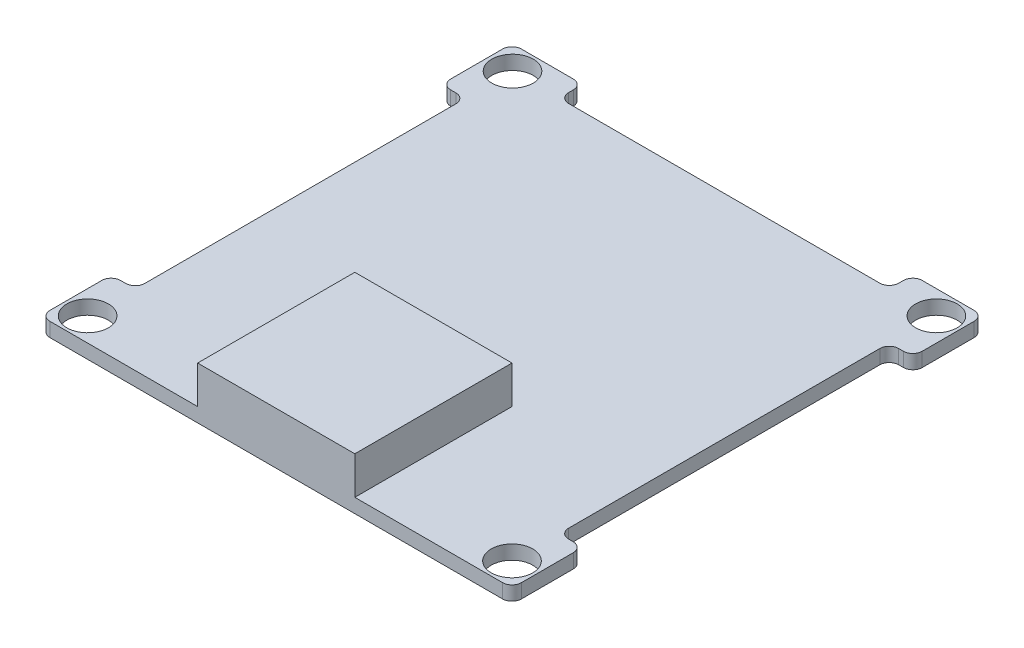
from build123d import *

# Parameters (mm, degrees)
SKETCH1_W           = 50
SKETCH1_H           = 50
SKETCH1_R           = 2.2
BOSS_EXTRUDE1_DEPTH = 1.5
SKETCH3_W           = 2.555545098
SKETCH3_H           = 35
SKETCH3_W_2         = 2.5
SKETCH3_W_3         = 35
SKETCH3_H_2         = 2.5
CUT_EXTRUDE1_DEPTH  = 1.5
FILLET8_R           = 1
SKETCH4_W           = 16.6666
SKETCH4_H           = 16.6666
BOSS_EXTRUDE2_DEPTH = 4


with BuildPart() as part:
    # Sketch1 → Boss-Extrude1 (new body)
    with BuildSketch(Plane(origin=(0, 0, 0), x_dir=(1, 0, 0), z_dir=(0, 1, 0))):
        with Locations((25, 25)):
            Rectangle(SKETCH1_W, SKETCH1_H)
        with Locations(Location((2.555545098, 47.5, 0), (0, 0, 270))):
            Circle(SKETCH1_R, mode=Mode.SUBTRACT)
        with Locations(Location((47.5, 47.5, 0), (0, 0, 270))):
            Circle(SKETCH1_R, mode=Mode.SUBTRACT)
        with Locations(Location((2.5, 2.5, 0), (0, 0, 270))):
            Circle(SKETCH1_R, mode=Mode.SUBTRACT)
        with Locations(Location((47.5, 2.5, 0), (0, 0, 270))):
            Circle(SKETCH1_R, mode=Mode.SUBTRACT)
    extrude(amount=BOSS_EXTRUDE1_DEPTH)

    # Sketch3 → Cut-Extrude1 (cut)
    with BuildSketch(Plane(origin=(0, 0, 0), x_dir=(1, 0, 0), z_dir=(0, 1, 0))):
        with Locations((1.277772549, 25)):
            Rectangle(SKETCH3_W, SKETCH3_H)
        with Locations((48.75, 25)):
            Rectangle(SKETCH3_W_2, SKETCH3_H)
        with Locations((25, 48.75)):
            Rectangle(SKETCH3_W_3, SKETCH3_H_2)
    extrude(amount=CUT_EXTRUDE1_DEPTH, mode=Mode.SUBTRACT)

    # Fillet8
    fillet8_edges = [part.edges().sort_by_distance(p)[0] for p in [
        (0, 0.75, -7.5),
        (2.555545098, 0.75, -7.5),
        (2.555545098, 0.75, -42.5),
        (0, 0.75, -42.5),
        (47.5, 0.75, -7.5),
        (50, 0.75, -7.5),
        (50, 0.75, -42.5),
        (47.5, 0.75, -42.5),
        (7.5, 0.75, -47.5),
        (42.5, 0.75, -47.5),
        (42.5, 0.75, -50),
        (7.5, 0.75, -50),
        (0, 0.75, -50),
        (50, 0.75, -50),
        (50, 0.75, 0),
        (0, 0.75, 0),
    ]]
    fillet(fillet8_edges, radius=FILLET8_R)

    # Sketch4 → Boss-Extrude2 (add)
    with BuildSketch(Plane(origin=(0, 1.5, 0), x_dir=(1, 0, 0), z_dir=(0, 1, 0))):
        with Locations((25, 8.3333)):
            Rectangle(SKETCH4_W, SKETCH4_H)
    extrude(amount=BOSS_EXTRUDE2_DEPTH)


solid = part.part
